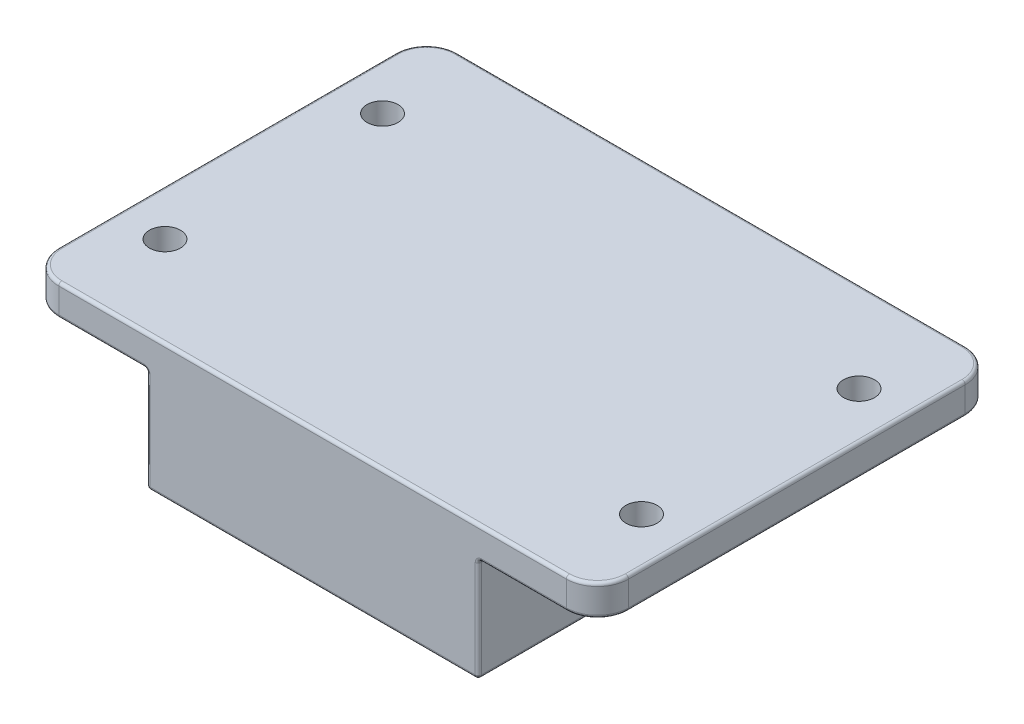
from build123d import *

# Parameters (mm, degrees)
SKETCH_1_W          = 55
SKETCH_1_H          = 38.5
EXTRUDE_1_DEPTH     = 3
FILLET_1_R          = 3
SKETCH_2_R          = 1.5
CUT_EXTRUDE_1_DEPTH = 3
SKETCH_3_W          = 32
SKETCH_3_H          = 38.5
EXTRUDE_2_DEPTH     = 10
CUT_EXTRUDE_2_DEPTH = 10
FILLET_2_R          = 0.3
FILLET_3_R          = 0.3


with BuildPart() as part:
    # 草图1 → 凸台-拉伸1 (new body)
    with BuildSketch(Plane(origin=(0, 0, 0), x_dir=(1, 0, 0), z_dir=(0, 1, 0))):
        Rectangle(SKETCH_1_W, SKETCH_1_H)
    extrude(amount=EXTRUDE_1_DEPTH)

    # 圆角1
    fillet_1_edges = [part.edges().sort_by_distance(p)[0] for p in [
        (27.5, 1.5, 19.25),
        (-27.5, 1.5, 19.25),
        (-27.5, 1.5, -19.25),
        (27.5, 1.5, -19.25),
    ]]
    fillet(fillet_1_edges, radius=FILLET_1_R)

    # 草图2 → 切除-拉伸1 (cut)
    with BuildSketch(Plane.XZ):
        with Locations(Location((-23, 10.5, 0), (0, 0, 270))):
            Circle(SKETCH_2_R)
        with Locations(Location((23, 10.5, 0), (0, 0, 90))):
            Circle(SKETCH_2_R)
        with Locations(Location((23, -10.5, 0), (0, 0, 270))):
            Circle(SKETCH_2_R)
        with Locations(Location((-23, -10.5, 0), (0, 0, 90))):
            Circle(SKETCH_2_R)
    extrude(amount=-CUT_EXTRUDE_1_DEPTH, mode=Mode.SUBTRACT)

    # 草图3 → 凸台-拉伸2 (add)
    with BuildSketch(Plane.XZ):
        Rectangle(SKETCH_3_W, SKETCH_3_H)
    extrude(amount=EXTRUDE_2_DEPTH)

    # 草图4 → 切除-拉伸2 (cut)
    with BuildSketch(Plane(origin=(0, 0, -19.25), x_dir=(-1, 0, 0), z_dir=(0, 0, -1))):
        with BuildLine():
            Line((-10.355216477, -3.177174499), (-4.766145944, -3.177174499))
            ThreePointArc((-4.766145944, -3.177174499), (-2.965338976, -4.977981467), (-4.766145944, -6.778788435))
            Line((-4.766145944, -6.778788435), (-10.355216477, -6.778788435))
            ThreePointArc((-10.355216477, -6.778788435), (-12.156023445, -4.977981467), (-10.355216477, -3.177174499))
        make_face()
        Polygon((3.50379775, -3.251981944), (8.218783887, -3.251981944), (9.195130237, -4.228328293), (9.739024451, -5.770068099), (1.983557186, -5.770068099), (2.5274514, -4.228328293), align=None)
    extrude(amount=-CUT_EXTRUDE_2_DEPTH, mode=Mode.SUBTRACT)

    # 圆角2
    fillet_2_edges = [part.edges().sort_by_distance(p)[0] for p in [
        (-9.739024451, -5.770068099, -14.25),
        (-1.983557186, -5.770068099, -14.25),
    ]]
    fillet(fillet_2_edges, radius=FILLET_2_R)

    # 圆角3
    fillet_3_edges = [part.edges().sort_by_distance(p)[0] for p in [
        (-9.396555774, -4.799295514, -19.25),
        (-5.861290819, -5.770068099, -19.25),
        (-9.559959231, -5.643357439, -19.25),
        (-2.162622406, -5.643357439, -19.25),
        (20.25, 0, -19.25),
        (0, 3, -19.25),
        (27.5, 0, 0),
        (-20.25, 0, 19.25),
        (-27.5, 0, 0),
        (-26.621320344, 0, -18.371320344),
        (-26.621320344, 0, 18.371320344),
        (26.621320344, 0, 18.371320344),
        (26.621320344, 0, -18.371320344),
        (27.5, 3, 0),
        (-27.5, 3, 0),
        (0, 3, 19.25),
        (-26.621320344, 3, -18.371320344),
        (-26.621320344, 3, 18.371320344),
        (26.621320344, 3, 18.371320344),
        (26.621320344, 3, -18.371320344),
        (-20.25, 0, -19.25),
        (20.25, 0, 19.25),
        (16, -5, 19.25),
        (-16, 0, 0),
        (-16, -5, 19.25),
        (-16, -5, -19.25),
        (16, 0, 0),
        (16, -5, -19.25),
        (0, -10, 19.25),
        (-16, -10, 0),
        (0, -10, -19.25),
        (16, -10, 0),
        (12.156023445, -4.977981467, -19.25),
        (7.560681211, -6.778788435, -19.25),
        (2.965338976, -4.977981467, -19.25),
        (7.560681211, -3.177174499, -19.25),
        (-3.015624575, -3.740155118, -19.25),
        (-2.326025863, -4.799295514, -19.25),
        (-8.706957062, -3.740155118, -19.25),
        (-5.861290819, -3.251981944, -19.25),
    ]]
    fillet(fillet_3_edges, radius=FILLET_3_R)


solid = part.part
